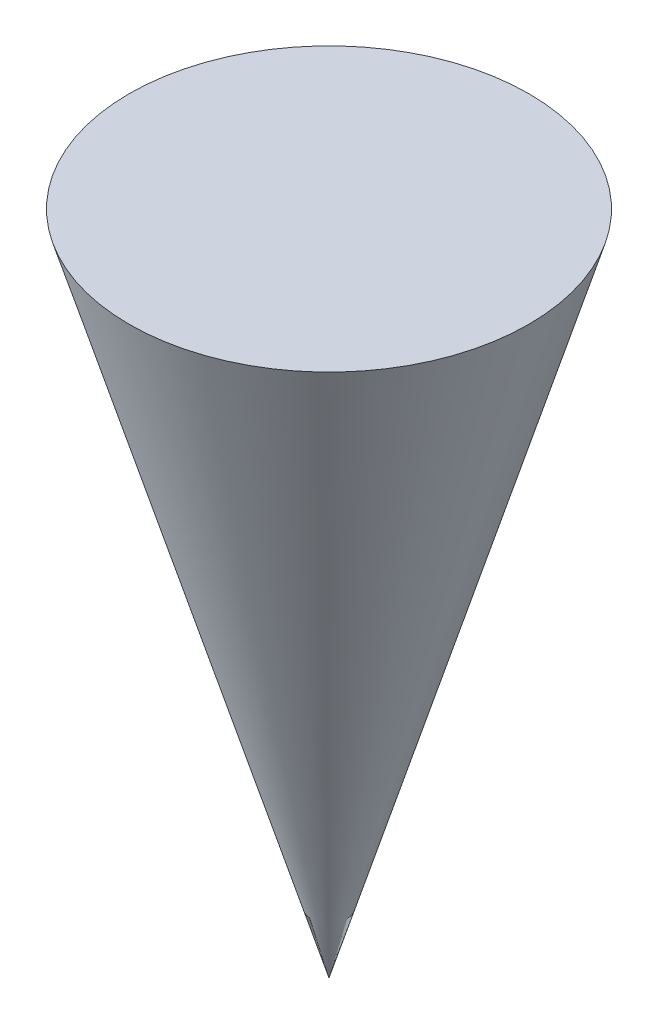
from build123d import *


with BuildPart() as part:
    # Sketch2 → Revolve1 (revolve)
    with BuildSketch(Plane.XY, mode=Mode.PRIVATE) as revolve1_sk:
        Polygon((0, 0), (30, 0), (0, -100), align=None)
    revolve(revolve1_sk.sketch.rotate(Axis((0, -100, 0), (0, 1, 0)), 180), axis=Axis((0, -100, 0), (0, 1, 0)))


solid = part.part
